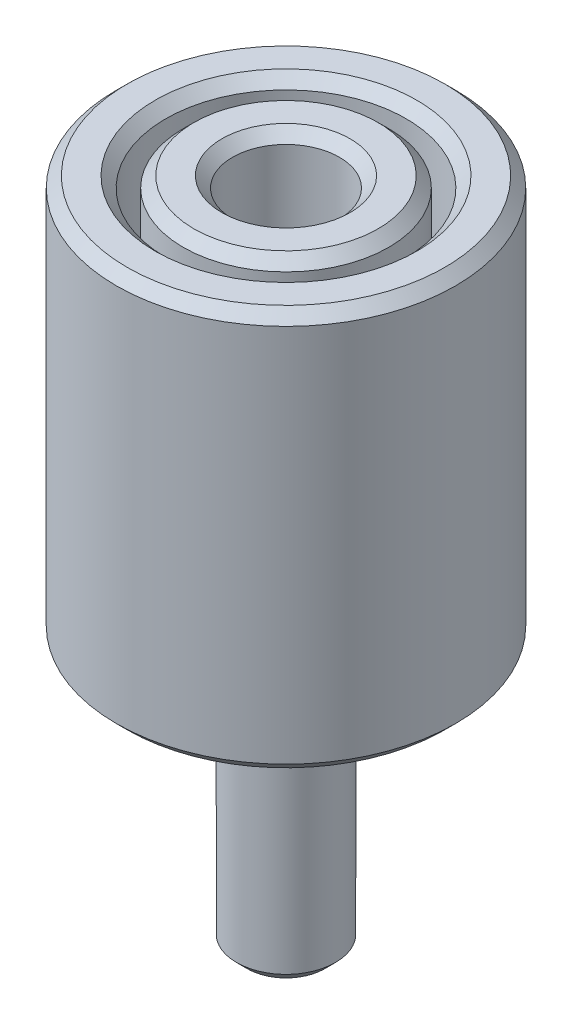
from build123d import *

# Parameters (mm, degrees)
CHAMFER_2_SIZE = 0.4


with BuildPart() as part:
    # Эскиз1 → Повернуть1 (revolve)
    with BuildSketch(Plane.XY, mode=Mode.PRIVATE) as revolve_1_sk:
        Polygon((-6.35, 25), (-6.35, 10), (-2.5, 10), (-2.5, 9), (-1.85, 9), (-1.85, 0), (0, 0), (0, 11.499600798), (-2, 11.499600798), (-2, 25), (-3.85, 25), (-3.85, 11.499600798), (-4.5, 11.499600798), (-4.5, 25), align=None)
    revolve(revolve_1_sk.sketch.rotate(Axis((0, 11.499600798, 0), (0, -1, 0)), 270), axis=Axis((0, 11.499600798, 0), (0, -1, 0)))

    # Фаска2
    chamfer_2_edges = [part.edges().sort_by_distance(p)[0] for p in [
        (0, 0, -1.85),
        (0, 10, -6.35),
        (0, 25, -6.35),
        (0, 25, -4.5),
        (0, 25, -3.85),
        (0, 25, -2),
    ]]
    chamfer(chamfer_2_edges, length=CHAMFER_2_SIZE)


solid = part.part
